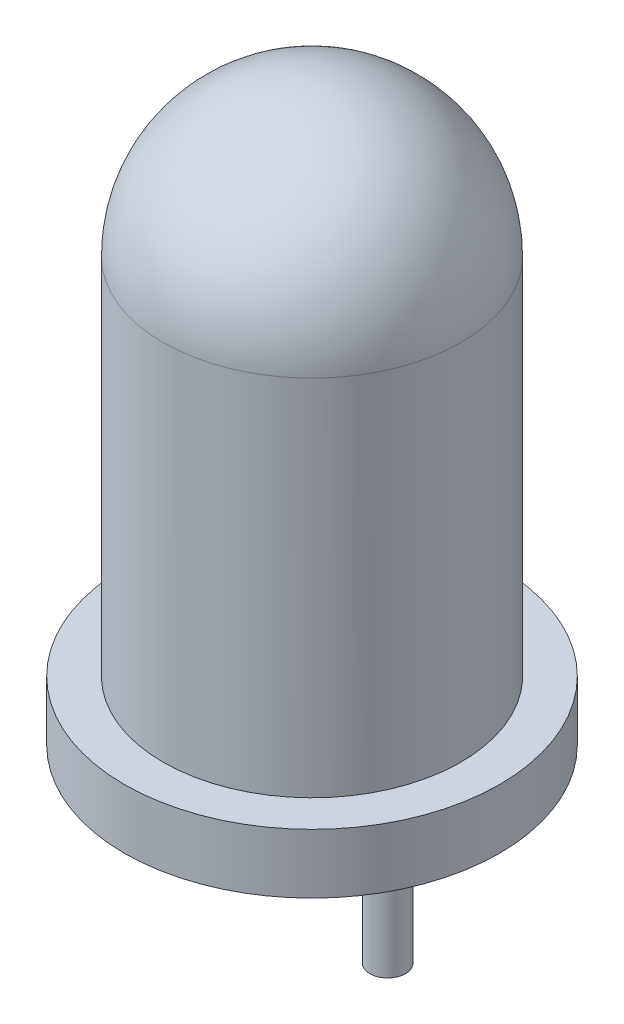
from build123d import *

# Parameters (mm, degrees)
SKETCH2_R           = 0.3
BOSS_EXTRUDE1_DEPTH = 2.54


with BuildPart() as part:
    # Sketch1 → Revolve1 (revolve)
    with BuildSketch(Plane.XY, mode=Mode.PRIVATE) as revolve1_sk:
        with BuildLine():
            Line((2.5, 7.1), (2.5, 1))
            Line((2.5, 1), (3.148870311, 1))
            Line((3.148870311, 1), (3.148870311, 0))
            Line((3.148870311, 0), (0, 0))
            Line((0, 0), (0, 7.1))
            Line((0, 7.1), (0, 9.6))
            ThreePointArc((0, 9.6), (1.767766953, 8.867766953), (2.5, 7.1))
        make_face()
    revolve(revolve1_sk.sketch.rotate(Axis((0, 7.1, 0), (0, -1, 0)), 90), axis=Axis((0, 7.1, 0), (0, -1, 0)))

    # Sketch2 → Boss-Extrude1 (add)
    with BuildSketch(Plane.XZ):
        with Locations(Location((-1.27, 0, 0), (0, 0, 90))):
            Circle(SKETCH2_R)
        with Locations(Location((1.27, 0, 0), (0, 0, 90))):
            Circle(SKETCH2_R)
    extrude(amount=BOSS_EXTRUDE1_DEPTH)


solid = part.part
